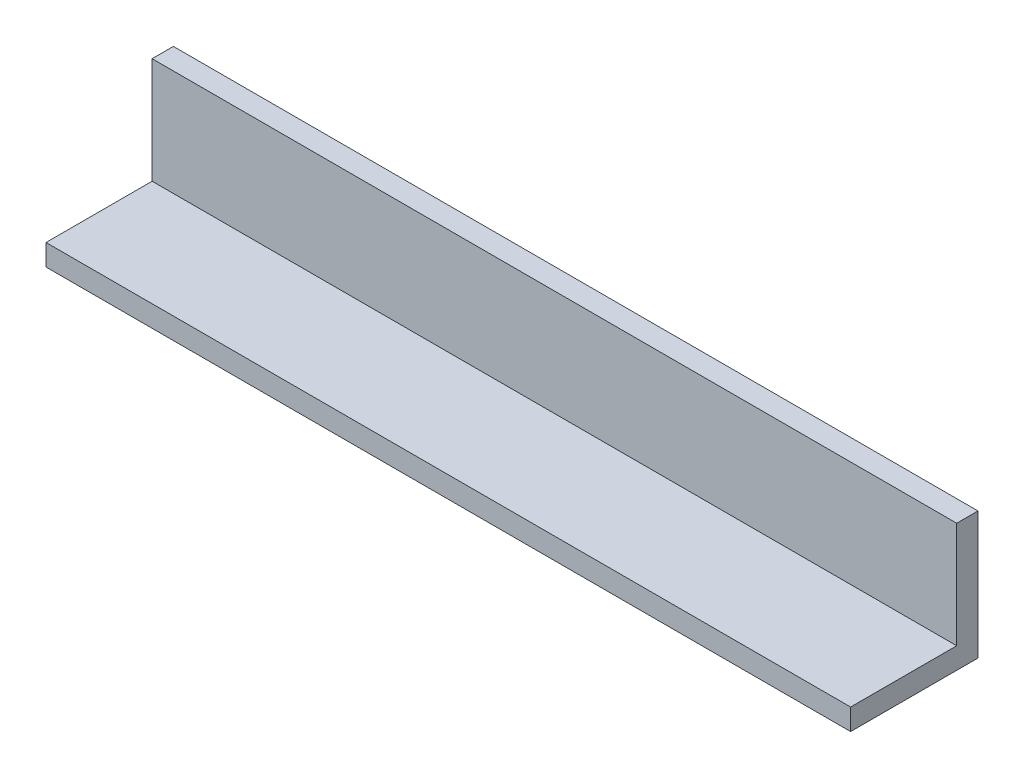
from build123d import *

# Parameters (mm, degrees)
CROQUIS1_W              = 240
CROQUIS1_H              = 38
SALIENTE_EXTRUIR1_DEPTH = 6.35
CROQUIS2_W              = 240
CROQUIS2_H              = 6.35
SALIENTE_EXTRUIR2_DEPTH = 31.65


with BuildPart() as part:
    # Croquis1 → Saliente-Extruir1 (new body)
    with BuildSketch(Plane(origin=(0, 0, 0), x_dir=(1, 0, 0), z_dir=(0, 1, 0))):
        Rectangle(CROQUIS1_W, CROQUIS1_H)
    extrude(amount=SALIENTE_EXTRUIR1_DEPTH)

    # Croquis2 → Saliente-Extruir2 (add)
    with BuildSketch(Plane(origin=(0, 6.35, 0), x_dir=(1, 0, 0), z_dir=(0, 1, 0))):
        with Locations((0, 15.825)):
            Rectangle(CROQUIS2_W, CROQUIS2_H)
    extrude(amount=SALIENTE_EXTRUIR2_DEPTH)


solid = part.part
